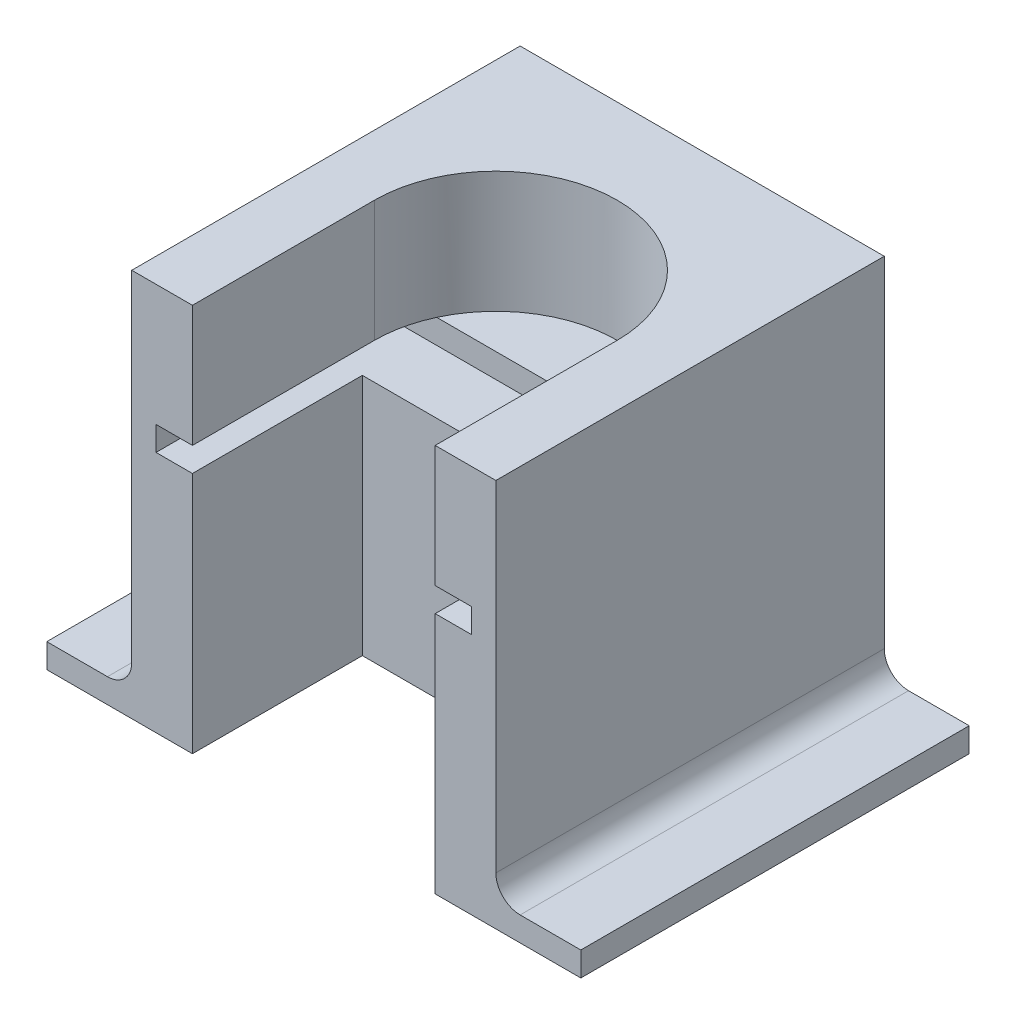
from build123d import *

# Parameters (mm, degrees)
SKETCH1_W           = 30
SKETCH1_H           = 28
BOSS_EXTRUDE1_DEPTH = 20
SKETCH2_W           = 5
SKETCH2_H           = 28
BOSS_EXTRUDE2_DEPTH = 12
SKETCH3_W           = 3
SKETCH3_H           = 2
CUT_EXTRUDE1_DEPTH  = 53.038447325
SKETCH4_W           = 20
SKETCH4_H           = 20
CUT_EXTRUDE2_DEPTH  = 14
SKETCH5_W           = 7
SKETCH5_H           = 2
BOSS_EXTRUDE3_DEPTH = 28
FILLET1_R           = 2
BOSS_EXTRUDE5_DEPTH = 10
SKETCH8_W           = 26
SKETCH8_H           = 2
BOSS_EXTRUDE6_DEPTH = 8.8
BOSS_EXTRUDE7_DEPTH = 4


with BuildPart() as part:
    # Sketch1 → Boss-Extrude1 (new body)
    with BuildSketch(Plane(origin=(0, 0, 0), x_dir=(1, 0, 0), z_dir=(0, 1, 0))):
        with Locations((-15, 14)):
            Rectangle(SKETCH1_W, SKETCH1_H)
    extrude(amount=BOSS_EXTRUDE1_DEPTH)

    # Sketch2 → Boss-Extrude2 (add)
    with BuildSketch(Plane(origin=(0, 20, 0), x_dir=(1, 0, 0), z_dir=(0, 1, 0))):
        with Locations((-27.5, 14)):
            Rectangle(SKETCH2_W, SKETCH2_H)
        with Locations((-2.5, 14)):
            Rectangle(SKETCH2_W, SKETCH2_H)
    extrude(amount=BOSS_EXTRUDE2_DEPTH)

    # Sketch3 → Cut-Extrude1 (cut, through all)
    with BuildSketch(Plane.XY):
        with Locations((-3.5, 21)):
            Rectangle(SKETCH3_W, SKETCH3_H)
        with Locations((-26.5, 21)):
            Rectangle(SKETCH3_W, SKETCH3_H)
    extrude(amount=-CUT_EXTRUDE1_DEPTH, mode=Mode.SUBTRACT)

    # Sketch4 → Cut-Extrude2 (cut)
    with BuildSketch(Plane.XY):
        with Locations((-15, 10)):
            Rectangle(SKETCH4_W, SKETCH4_H)
    extrude(amount=-CUT_EXTRUDE2_DEPTH, mode=Mode.SUBTRACT)

    # Sketch5 → Boss-Extrude3 (add)
    with BuildSketch(Plane(origin=(0, 0, -28), x_dir=(-1, 0, 0), z_dir=(0, 0, -1))):
        with Locations((33.5, 1)):
            Rectangle(SKETCH5_W, SKETCH5_H)
        with Locations((-3.5, 1)):
            Rectangle(SKETCH5_W, SKETCH5_H)
    extrude(amount=-BOSS_EXTRUDE3_DEPTH)

    # Fillet1
    fillet1_edges = [part.edges().sort_by_distance(p)[0] for p in [
        (-30, 2, -14),
        (0, 2, -14),
    ]]
    fillet(fillet1_edges, radius=FILLET1_R)

    # Sketch7 → Boss-Extrude5 (add)
    with BuildSketch(Plane(origin=(0, 32, 0), x_dir=(1, 0, 0), z_dir=(0, 1, 0))):
        with BuildLine():
            Line((-25, 15), (-25, 28))
            Line((-25, 28), (-5, 28))
            Line((-5, 28), (-5, 15))
            ThreePointArc((-5, 15), (-15, 25), (-25, 15))
        make_face()
    extrude(amount=-BOSS_EXTRUDE5_DEPTH)

    # Sketch8 → Boss-Extrude6 (add)
    with BuildSketch(Plane(origin=(0, 0, -28), x_dir=(-1, 0, 0), z_dir=(0, 0, -1))):
        with Locations((15, 21)):
            Rectangle(SKETCH8_W, SKETCH8_H)
    extrude(amount=-BOSS_EXTRUDE6_DEPTH)

    # Sketch10 → Boss-Extrude7 (add)
    with BuildSketch(Plane(origin=(0, 0, -28), x_dir=(-1, 0, 0), z_dir=(0, 0, -1))):
        with BuildLine():
            Line((30, 4), (30, 32))
            Line((30, 32), (0, 32))
            Line((0, 32), (0, 4))
            ThreePointArc((0, 4), (-0.585786438, 2.585786438), (-2, 2))
            Line((-2, 2), (-7, 2))
            Line((-7, 2), (-7, 0))
            Line((-7, 0), (37, 0))
            Line((37, 0), (37, 2))
            Line((37, 2), (32, 2))
            ThreePointArc((32, 2), (30.585786438, 2.585786438), (30, 4))
        make_face()
    extrude(amount=BOSS_EXTRUDE7_DEPTH)


solid = part.part
